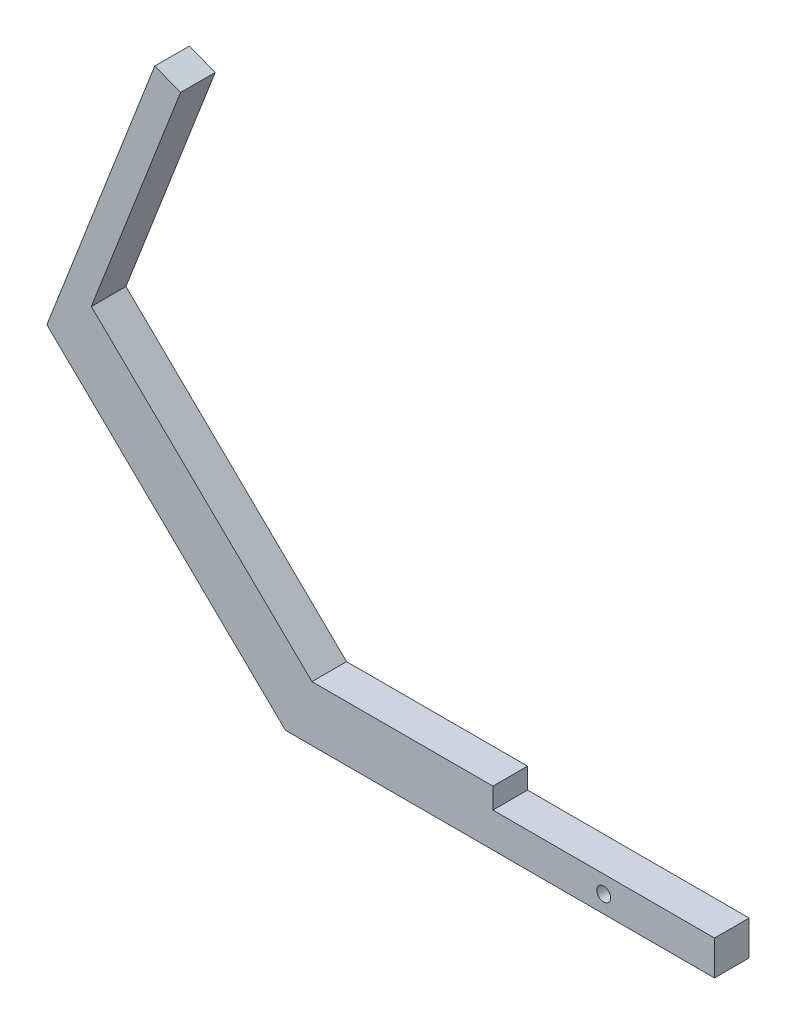
from build123d import *

# Parameters (mm, degrees)
EXTRUDE_2_DEPTH = 25
SKETCH_3_W      = 160
SKETCH_3_H      = 25
SKETCH_3_R      = 5
EXTRUDE_3_DEPTH = 25


with BuildPart() as part:
    # 草图1 → 凸台-拉伸2 (new body)
    with BuildSketch(Plane.XY):
        Polygon((0, 0), (0, -40), (-149.841058107, -40), (-322.072943576, 127.48172604), (-244.168859764, 328.224008492), (-225.523676843, 320.988184155), (-289.976254661, 154.907576464), (-130.675150004, 0), align=None)
    extrude(amount=EXTRUDE_2_DEPTH)

    # 草图3 → 凸台-拉伸3 (add)
    with BuildSketch(Plane(origin=(0, 0, 0), x_dir=(-1, 0, 0), z_dir=(0, 0, -1))):
        with Locations((-80, -27.5)):
            Rectangle(SKETCH_3_W, SKETCH_3_H)
        with Locations((-80, -27.5)):
            Circle(SKETCH_3_R, mode=Mode.SUBTRACT)
    extrude(amount=-EXTRUDE_3_DEPTH)


solid = part.part
